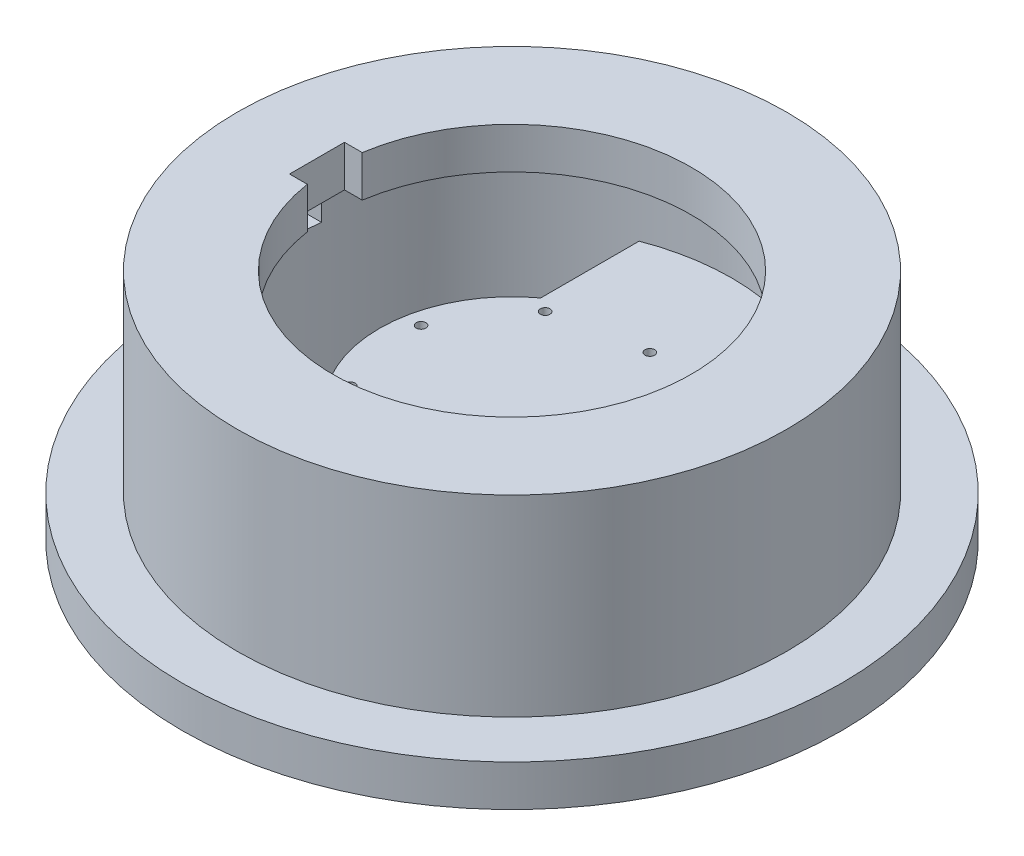
from build123d import *

# Parameters (mm, degrees)
SKETCH_1_R           = 120
EXTRUDE_1_DEPTH      = 15
SKETCH_2_R           = 100
EXTRUDE_2_DEPTH      = 70
SKETCH_3_R           = 80
CUT_EXTRUDE_1_DEPTH  = 70
SKETCH_4_R           = 48.25
CUT_EXTRUDE_2_DEPTH  = 65
EXTRUDE_START        = 30
SKETCH_6_R           = 48.25
EXTRUDE_3_DEPTH      = 12.7
EXTRUDE_4_DEPTH      = 85.7
EXTRUDE_4_DEPTH_BACK = 88.7
SKETCH_8_W           = 57.818005318
SKETCH_8_H           = 12.779998275
FILLET_1_R           = 20
FILLET_2_R           = 20
SKETCH_10_W          = 23.933516112
SKETCH_10_H          = 20
CUT_EXTRUDE_3_DEPTH  = 25
SKETCH_11_R          = 65.278053168
CUT_EXTRUDE_4_DEPTH  = 19
SKETCH_12_W          = 20
SKETCH_12_H          = 14.412930018
CUT_EXTRUDE_5_DEPTH  = 165
SKETCH_13_R          = 1.75
CUT_EXTRUDE_6_DEPTH  = 25


with BuildPart() as part:
    # 草图1 → 凸台-拉伸1 (new body)
    with BuildSketch(Plane(origin=(0, 0, 0), x_dir=(1, 0, 0), z_dir=(0, 1, 0))):
        with Locations(Location((0, 0, 0), (0, 0, 270))):
            Circle(SKETCH_1_R)
    extrude(amount=EXTRUDE_1_DEPTH)

    # 草图2 → 凸台-拉伸2 (add)
    with BuildSketch(Plane(origin=(0, 15, 0), x_dir=(1, 0, 0), z_dir=(0, 1, 0))):
        with Locations(Location((0, 0, 0), (0, 0, 270))):
            Circle(SKETCH_2_R)
    extrude(amount=EXTRUDE_2_DEPTH)

    # 草图3 → 切除-拉伸1 (cut)
    with BuildSketch(Plane.XZ):
        with Locations(Location((0, 0, 0), (0, 0, 270))):
            Circle(SKETCH_3_R)
    extrude(amount=-CUT_EXTRUDE_1_DEPTH, mode=Mode.SUBTRACT)

    # 草图4 → 切除-拉伸2 (cut)
    with BuildSketch(Plane(origin=(0, 85, 0), x_dir=(1, 0, 0), z_dir=(0, 1, 0))):
        with Locations(Location((0, 0, 0), (0, 0, 270))):
            Circle(SKETCH_4_R)
    extrude(amount=-CUT_EXTRUDE_2_DEPTH, mode=Mode.SUBTRACT)



with BuildPart() as body_2:
    # 草图6 → 凸台-拉伸3 (new body)
    with BuildSketch(Plane(origin=(0, 0, 0), x_dir=(1, 0, 0), z_dir=(0, 1, 0)).offset(EXTRUDE_START)):
        with Locations(Location((0, 0, 0), (0, 0, 270))):
            Circle(SKETCH_6_R)
    extrude(amount=EXTRUDE_3_DEPTH)


with BuildPart() as part_1:
    add(part.part)

    add(body_2.part)  # 凸台-拉伸4 merges body 2
    # 草图8 → 凸台-拉伸4 (add, two sides: drawn at the far end of the back side and taken through both)
    with BuildSketch(Plane.XY.offset(-EXTRUDE_4_DEPTH_BACK)):
        with Locations((0.416556234, 36.310000863)):
            Rectangle(SKETCH_8_W, SKETCH_8_H)
    extrude(amount=EXTRUDE_4_DEPTH + EXTRUDE_4_DEPTH_BACK)

    # 圆角1
    fillet_1_edges = [part_1.edges().sort_by_distance(p)[0] for p in [
        (0.446745886, 29.920001725, 79.998752603),
    ]]
    fillet(fillet_1_edges, radius=FILLET_1_R)

    # 圆角2
    fillet_2_edges = [part_1.edges().sort_by_distance(p)[0] for p in [
        (14.924805984, 29.920001725, -78.595484389),
    ]]
    fillet(fillet_2_edges, radius=FILLET_2_R)

    # 草图10 → 切除-拉伸3 (cut)
    with BuildSketch(Plane(origin=(0, 85, 0), x_dir=(1, 0, 0), z_dir=(0, 1, 0))):
        with Locations((-59, 0)):
            Rectangle(SKETCH_10_W, SKETCH_10_H)
    extrude(amount=-CUT_EXTRUDE_3_DEPTH, mode=Mode.SUBTRACT)

    # 草图11 → 切除-拉伸4 (cut)
    with BuildSketch(Plane(origin=(0, 85, 0), x_dir=(1, 0, 0), z_dir=(0, 1, 0))):
        Circle(SKETCH_11_R)
    extrude(amount=-CUT_EXTRUDE_4_DEPTH, mode=Mode.SUBTRACT)

    # 草图12 → 切除-拉伸5 (cut)
    with BuildSketch(Plane(origin=(29.325558893, 0, 0), x_dir=(0, 0, -1), z_dir=(1, 0, 0))):
        with Locations((0, 62.793534991)):
            Rectangle(SKETCH_12_W, SKETCH_12_H)
    extrude(amount=-CUT_EXTRUDE_5_DEPTH, mode=Mode.SUBTRACT)

    # 草图13 → 切除-拉伸6 (cut)
    with BuildSketch(Plane.XZ.offset(-29.920001725)):
        with Locations(Location((-8.532886067, 41.634599258, 0), (0, 0, 270))):
            Circle(SKETCH_13_R)
        with Locations(Location((23.406445866, 35.473769068, 0), (0, 0, 270))):
            Circle(SKETCH_13_R)
        with Locations(Location((41.634599258, 8.532886067, 0), (0, 0, 90))):
            Circle(SKETCH_13_R)
        with Locations(Location((35.473769068, -23.406445866, 0), (0, 0, 90))):
            Circle(SKETCH_13_R)
        with Locations(Location((8.532886067, -41.634599258, 0), (0, 0, 270))):
            Circle(SKETCH_13_R)
        with Locations(Location((-23.406445866, -35.473769068, 0), (0, 0, 270))):
            Circle(SKETCH_13_R)
        with Locations(Location((-41.634599258, -8.532886067, 0), (0, 0, 90))):
            Circle(SKETCH_13_R)
        with Locations(Location((-35.473769068, 23.406445866, 0), (0, 0, 90))):
            Circle(SKETCH_13_R)
    extrude(amount=-CUT_EXTRUDE_6_DEPTH, mode=Mode.SUBTRACT)


solid = part_1.part
